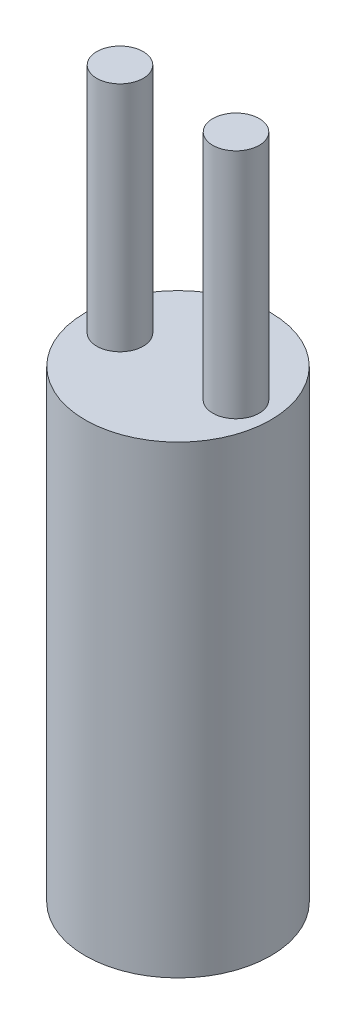
from build123d import *

# Parameters (mm, degrees)
SKETCH_1_R      = 4
EXTRUDE_1_DEPTH = 20
SKETCH_2_R      = 1
EXTRUDE_2_DEPTH = 10


with BuildPart() as part:
    # 草图1 → 凸台-拉伸1 (new body)
    with BuildSketch(Plane(origin=(0, 0, 0), x_dir=(1, 0, 0), z_dir=(0, 1, 0))):
        with Locations(Location((0, 0, 0), (0, 0, 270))):
            Circle(SKETCH_1_R)
    extrude(amount=EXTRUDE_1_DEPTH)

    # 草图2 → 凸台-拉伸2 (add)
    with BuildSketch(Plane(origin=(0, 20, 0), x_dir=(1, 0, 0), z_dir=(0, 1, 0))):
        with Locations(Location((-2.5, 0, 0), (0, 0, 270))):
            Circle(SKETCH_2_R)
    extrude_2 = extrude(amount=EXTRUDE_2_DEPTH)

    # 镜向1: 凸台-拉伸2 across plane
    add(extrude_2.mirror(Plane(origin=(0, 0, 0), x_dir=(0, 0, 1), z_dir=(1, 0, 0))))

    # 草图4 → 旋转1 (revolve)
    with BuildSketch(Plane.XZ):
        with BuildLine():
            Line((0, 0.5), (0, -0.5))
            ThreePointArc((0, -0.5), (-0.5, 0), (0, 0.5))
        make_face()
    revolve(axis=Axis((0, 0, 0.5), (0, 0, -1)))


solid = part.part
